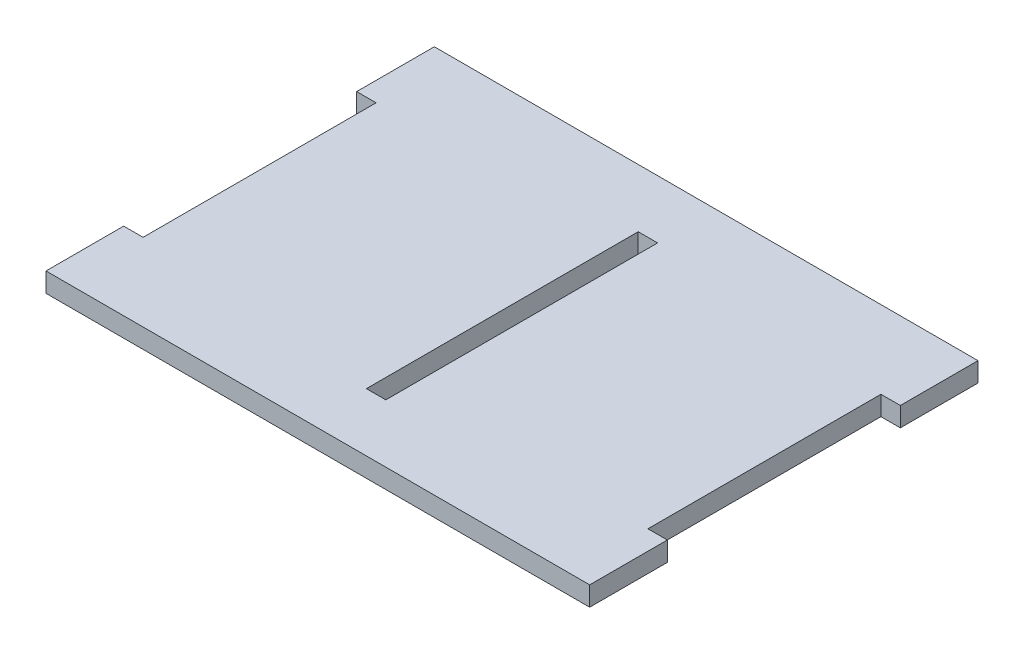
from build123d import *

# Parameters (mm, degrees)
BOSS_EXTRUDE1_DEPTH = 3.175
SKETCH2_W           = 3.175
SKETCH2_H           = 44.45
CUT_EXTRUDE1_DEPTH  = 3.175


with BuildPart() as part:
    # Sketch1 → Boss-Extrude1 (new body)
    with BuildSketch(Plane(origin=(0, 0, 0), x_dir=(1, 0, 0), z_dir=(0, 1, 0))):
        Polygon((-41.275, -19.05), (-41.275, 19.05), (-44.45, 19.05), (-44.45, 31.75), (-41.275, 31.75), (41.275, 31.75), (44.45, 31.75), (44.45, 19.05), (41.275, 19.05), (41.275, -19.05), (44.45, -19.05), (44.45, -31.75), (41.275, -31.75), (-41.275, -31.75), (-44.45, -31.75), (-44.45, -19.05), align=None)
    extrude(amount=BOSS_EXTRUDE1_DEPTH)

    # Sketch2 → Cut-Extrude1 (cut)
    with BuildSketch(Plane(origin=(0, 3.175, 0), x_dir=(1, 0, 0), z_dir=(0, 1, 0))):
        Rectangle(SKETCH2_W, SKETCH2_H)
    extrude(amount=-CUT_EXTRUDE1_DEPTH, mode=Mode.SUBTRACT)


solid = part.part
